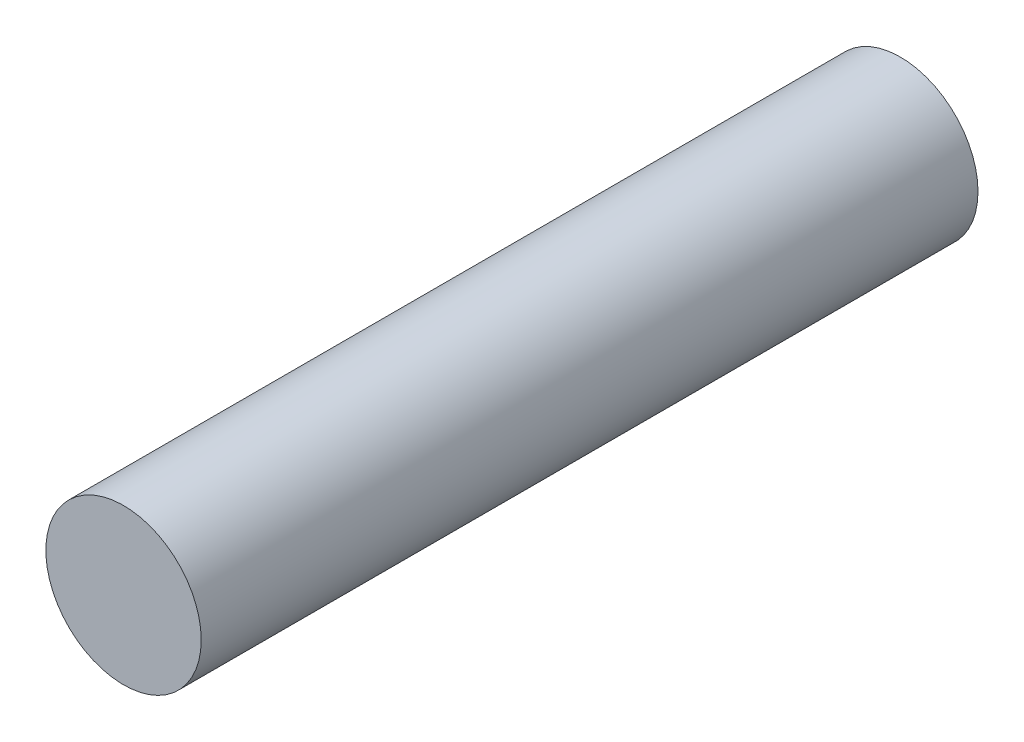
from build123d import *

# Parameters (mm, degrees)
SKETCH1_R           = 0.5
BOSS_EXTRUDE1_DEPTH = 2.5


with BuildPart() as part:
    # Sketch1 → Boss-Extrude1 (new, symmetric)
    with BuildSketch(Plane.XY):
        Circle(SKETCH1_R)
    extrude(amount=BOSS_EXTRUDE1_DEPTH, both=True)


solid = part.part
